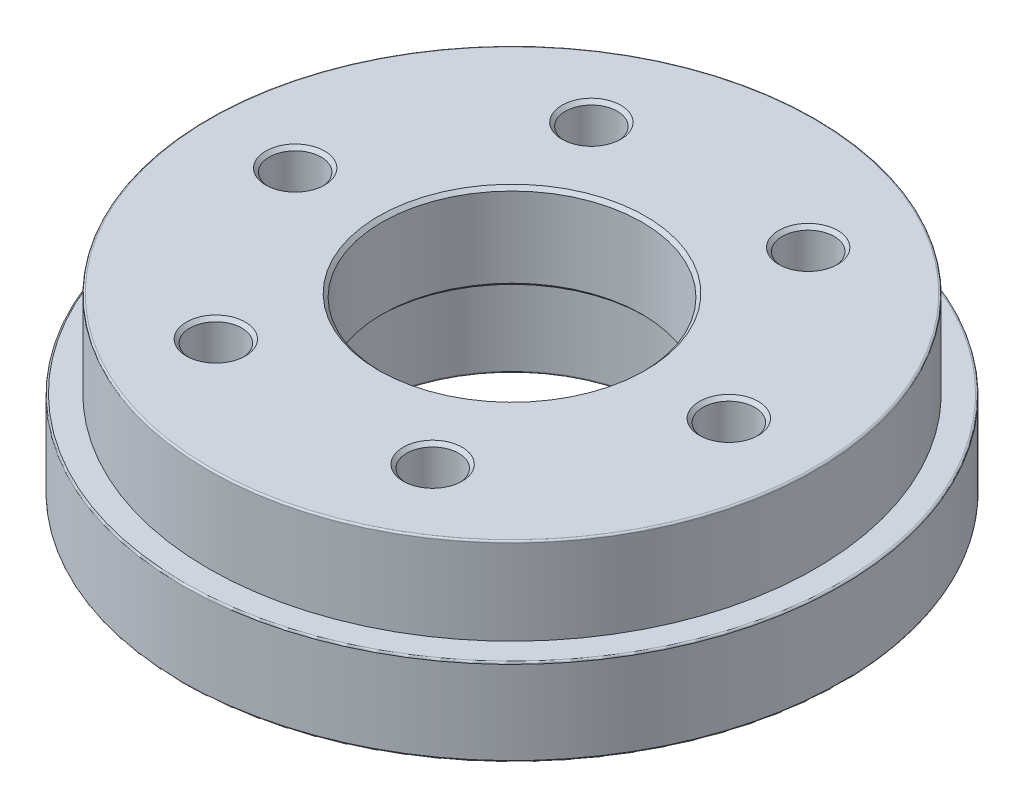
from build123d import *

# Parameters (mm, degrees)
SKETCH_1_R          = 19
EXTRUDE_1_DEPTH     = 5
SKETCH_1_3_R        = 3.05
CUT_EXTRUDE_1_DEPTH = 4
SKETCH_5_R          = 17.5
EXTRUDE_3_DEPTH     = 5
SKETCH_7_R          = 8.5
CUT_EXTRUDE_2_DEPTH = 5
SKETCH_8_R          = 7.5
CUT_EXTRUDE_3_DEPTH = 0.5
CUT_EXTRUDE_4_REACH = 30.671
SKETCH_10_R         = 1.5
CUT_EXTRUDE_5_DEPTH = 2
CUT_EXTRUDE_6_REACH = 30.671
SKETCH_12_R         = 7.5
CHAMFER_1_SIZE      = 0.2
FILLET_1_R          = 0.1
FILLET_2_R          = 0.1


with BuildPart() as part:
    # 草图1 → 凸台-拉伸1 (new body)
    with BuildSketch(Plane(origin=(0, 0, 0), x_dir=(1, 0, 0), z_dir=(0, 1, 0))):
        Circle(SKETCH_1_R)
    extrude(amount=EXTRUDE_1_DEPTH)

    # 草图1<3> → 切除-拉伸1 (cut)
    with BuildSketch(Plane(origin=(0, 0, 0), x_dir=(1, 0, 0), z_dir=(0, 1, 0))):
        with Locations((0, 15)):
            Circle(SKETCH_1_3_R)
        with Locations((12.990381057, 7.5)):
            Circle(SKETCH_1_3_R)
        with Locations((12.990381057, -7.5)):
            Circle(SKETCH_1_3_R)
        with Locations((0, -15)):
            Circle(SKETCH_1_3_R)
        with Locations((-12.990381057, -7.5)):
            Circle(SKETCH_1_3_R)
        with Locations((-12.990381057, 7.5)):
            Circle(SKETCH_1_3_R)
    extrude(amount=CUT_EXTRUDE_1_DEPTH, mode=Mode.SUBTRACT)

    # 草图5 → 凸台-拉伸3 (add)
    with BuildSketch(Plane(origin=(0, 5, 0), x_dir=(1, 0, 0), z_dir=(0, 1, 0))):
        Circle(SKETCH_5_R)
    extrude(amount=EXTRUDE_3_DEPTH)

    # 草图7 → 切除-拉伸2 (cut)
    with BuildSketch(Plane.XZ):
        Circle(SKETCH_7_R)
    extrude(amount=-CUT_EXTRUDE_2_DEPTH, mode=Mode.SUBTRACT)

    # 草图8 → 切除-拉伸3 (cut)
    with BuildSketch(Plane.XZ.offset(-5)):
        Circle(SKETCH_8_R)
    extrude(amount=-CUT_EXTRUDE_3_DEPTH, mode=Mode.SUBTRACT)

    # 草图10 → 切除-拉伸4 (cut, up to next)
    with BuildSketch(Plane.XZ, mode=Mode.PRIVATE) as cut_extrude_4_sk1:
        with Locations((6.25, 10.825317547)):
            Circle(SKETCH_10_R)
    cut_extrude_4_tool1 = extrude(cut_extrude_4_sk1.sketch, amount=-CUT_EXTRUDE_4_REACH, mode=Mode.PRIVATE) & part.part
    # 草图10 → 切除-拉伸4 (cut, up to next)
    with BuildSketch(Plane.XZ, mode=Mode.PRIVATE) as cut_extrude_4_sk2:
        with Locations((12.5, 0)):
            Circle(SKETCH_10_R)
    cut_extrude_4_tool2 = extrude(cut_extrude_4_sk2.sketch, amount=-CUT_EXTRUDE_4_REACH, mode=Mode.PRIVATE) & part.part
    # 草图10 → 切除-拉伸4 (cut, up to next)
    with BuildSketch(Plane.XZ, mode=Mode.PRIVATE) as cut_extrude_4_sk3:
        with Locations((6.25, -10.825317547)):
            Circle(SKETCH_10_R)
    cut_extrude_4_tool3 = extrude(cut_extrude_4_sk3.sketch, amount=-CUT_EXTRUDE_4_REACH, mode=Mode.PRIVATE) & part.part
    # 草图10 → 切除-拉伸4 (cut, up to next)
    with BuildSketch(Plane.XZ, mode=Mode.PRIVATE) as cut_extrude_4_sk4:
        with Locations((-6.25, -10.825317547)):
            Circle(SKETCH_10_R)
    cut_extrude_4_tool4 = extrude(cut_extrude_4_sk4.sketch, amount=-CUT_EXTRUDE_4_REACH, mode=Mode.PRIVATE) & part.part
    # 草图10 → 切除-拉伸4 (cut, up to next)
    with BuildSketch(Plane.XZ, mode=Mode.PRIVATE) as cut_extrude_4_sk5:
        with Locations((-12.5, 0)):
            Circle(SKETCH_10_R)
    cut_extrude_4_tool5 = extrude(cut_extrude_4_sk5.sketch, amount=-CUT_EXTRUDE_4_REACH, mode=Mode.PRIVATE) & part.part
    # 草图10 → 切除-拉伸4 (cut, up to next)
    with BuildSketch(Plane.XZ, mode=Mode.PRIVATE) as cut_extrude_4_sk6:
        with Locations((-6.25, 10.825317547)):
            Circle(SKETCH_10_R)
    cut_extrude_4_tool6 = extrude(cut_extrude_4_sk6.sketch, amount=-CUT_EXTRUDE_4_REACH, mode=Mode.PRIVATE) & part.part
    add(cut_extrude_4_tool1.solids().sort_by_distance((6.25, 0, 10.825318))[0], mode=Mode.SUBTRACT)
    add(cut_extrude_4_tool2.solids().sort_by_distance((12.5, 0, 0))[0], mode=Mode.SUBTRACT)
    add(cut_extrude_4_tool3.solids().sort_by_distance((6.25, 0, -10.825318))[0], mode=Mode.SUBTRACT)
    add(cut_extrude_4_tool4.solids().sort_by_distance((-6.25, 0, -10.825318))[0], mode=Mode.SUBTRACT)
    add(cut_extrude_4_tool5.solids().sort_by_distance((-12.5, 0, 0))[0], mode=Mode.SUBTRACT)
    add(cut_extrude_4_tool6.solids().sort_by_distance((-6.25, 0, 10.825318))[0], mode=Mode.SUBTRACT)

    # 草图11 → 切除-拉伸5 (cut)
    with BuildSketch(Plane.XZ):
        Polygon((6.25, -14.000744028), (9, -12.413030788), (9, -9.237604307), (6.25, -7.649891067), (3.5, -9.237604307), (3.5, -12.413030788), align=None)
        Polygon((15.25, -1.58771324), (15.25, 1.58771324), (12.5, 3.175426481), (9.75, 1.58771324), (9.75, -1.58771324), (12.5, -3.175426481), align=None)
        Polygon((-9, -12.413030788), (-6.25, -14.000744028), (-3.5, -12.413030788), (-3.5, -9.237604307), (-6.25, -7.649891067), (-9, -9.237604307), align=None)
        Polygon((-15.25, 1.58771324), (-15.25, -1.58771324), (-12.5, -3.175426481), (-9.75, -1.58771324), (-9.75, 1.58771324), (-12.5, 3.175426481), align=None)
        Polygon((-6.25, 14.000744028), (-9, 12.413030788), (-9, 9.237604307), (-6.25, 7.649891067), (-3.5, 9.237604307), (-3.5, 12.413030788), align=None)
        Polygon((9, 12.413030788), (6.25, 14.000744028), (3.5, 12.413030788), (3.5, 9.237604307), (6.25, 7.649891067), (9, 9.237604307), align=None)
    extrude(amount=-CUT_EXTRUDE_5_DEPTH, mode=Mode.SUBTRACT)

    # 草图12 → 切除-拉伸6 (cut, up to next)
    with BuildSketch(Plane(origin=(0, 10, 0), x_dir=(1, 0, 0), z_dir=(0, 1, 0)), mode=Mode.PRIVATE) as cut_extrude_6_sk1:
        Circle(SKETCH_12_R)
    cut_extrude_6_tool1 = extrude(cut_extrude_6_sk1.sketch, amount=-CUT_EXTRUDE_6_REACH, mode=Mode.PRIVATE) & part.part
    add(cut_extrude_6_tool1.solids().sort_by_distance((0, 10, 0))[0], mode=Mode.SUBTRACT)

    # 倒角1
    chamfer_1_edges = [part.edges().sort_by_distance(p)[0] for p in [
        (-14, 2, 0),
        (-14, 10, 0),
        (-7.75, 2, 10.825317547),
        (-7.75, 10, 10.825317547),
        (4.75, 2, 10.825317547),
        (4.75, 10, 10.825317547),
        (11, 2, 0),
        (11, 10, 0),
        (4.75, 2, -10.825317547),
        (4.75, 10, -10.825317547),
        (-7.75, 2, -10.825317547),
        (-7.75, 10, -10.825317547),
        (-7.5, 10, 0),
        (-7.5, 5, 0),
    ]]
    chamfer(chamfer_1_edges, length=CHAMFER_1_SIZE)

    # 圆角1
    fillet_1_edges = [part.edges().sort_by_distance(p)[0] for p in [
        (-19, 0, 0),
        (-19, 5, 0),
        (-8.5, 0, 0),
        (-17.5, 10, 0),
    ]]
    fillet(fillet_1_edges, radius=FILLET_1_R)

    # 圆角2
    fillet_2_edges = [part.edges().sort_by_distance(p)[0] for p in [
        (9.940381057, 0, 7.5),
        (9.940381057, 0, -7.5),
        (-3.05, 0, -15),
        (-16.040381057, 0, -7.5),
        (-16.040381057, 0, 7.5),
        (-3.05, 0, 15),
    ]]
    fillet(fillet_2_edges, radius=FILLET_2_R)


solid = part.part
